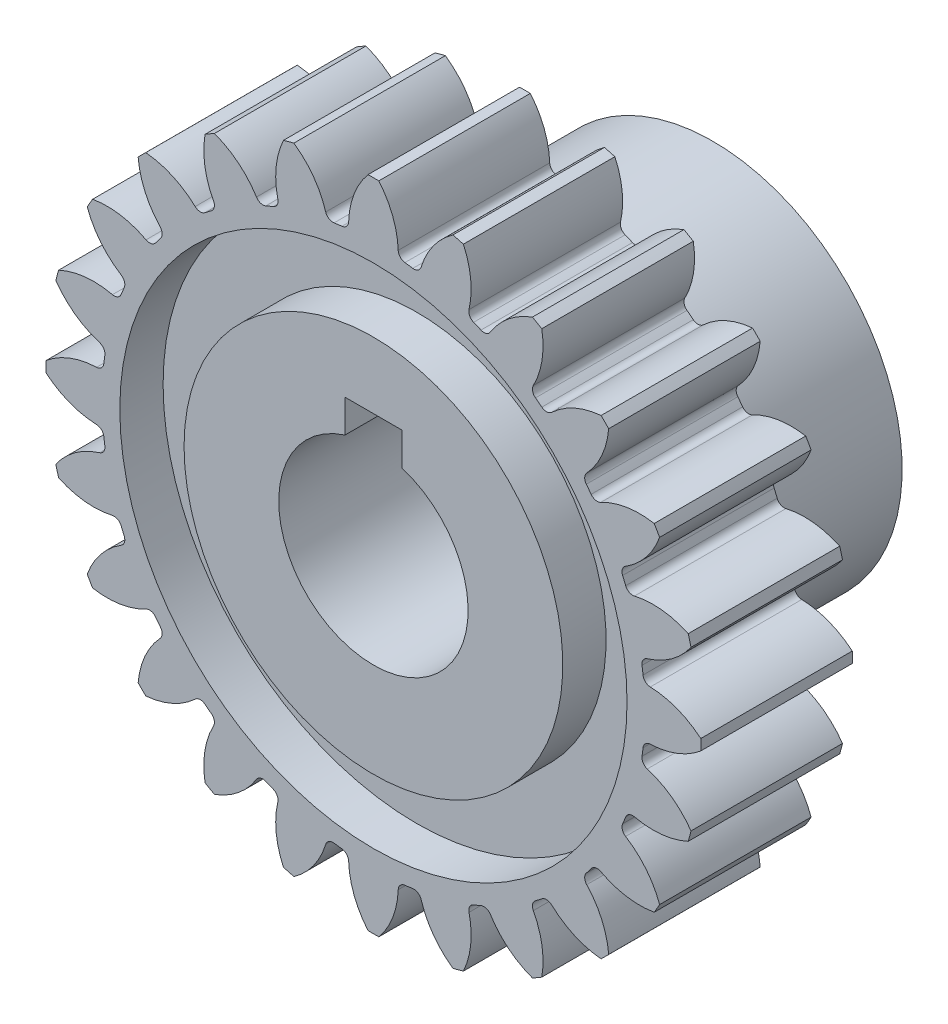
from build123d import *

# Parameters (mm, degrees)
CUT_EXTRUDE1_DEPTH = 25.060921741
CIRPATTERN1_COUNT  = 24
CUT_EXTRUDE2_DEPTH = 25.060921741


with BuildPart() as part:
    # Sketch3 → Revolve1 (revolve)
    with BuildSketch(Plane(origin=(0, 0, 0), x_dir=(0, 0, -1), z_dir=(1, 0, 0)), mode=Mode.PRIVATE) as revolve1_sk:
        Polygon((-7.112, 13.72235), (-0.762, 13.72235), (-0.762, 10.6299), (-2.576285714, 10.6299), (-2.576285714, 7.9375), (7.112, 7.9375), (7.112, 3.175), (-7.112, 3.175), (-7.112, 7.9375), (-5.297714286, 7.9375), (-5.297714286, 10.6299), (-7.112, 10.6299), align=None)
    revolve(revolve1_sk.sketch.rotate(Axis((0, 0, -7.112), (0, 0, 1)), 90), axis=Axis((0, 0, -7.112), (0, 0, 1)))

    # Sketch4 → Cut-Extrude1 (cut, symmetric)
    with BuildSketch(Plane.XY.offset(7.112)):
        with BuildLine():
            ThreePointArc((-0.226165225, 13.7204861), (-0.809623795, 12.730495659), (-1.039023964, 11.604493643))
            ThreePointArc((-1.039023964, 11.604493643), (-1.122909631, 11.400437837), (-1.319504028, 11.300306823))
            ThreePointArc((-1.319504028, 11.300306823), (-1.485007366, 11.279750808), (-1.650191603, 11.256770978))
            ThreePointArc((-1.650191603, 11.256770978), (-1.866003022, 11.302607737), (-1.999843883, 11.477999301))
            ThreePointArc((-1.999843883, 11.477999301), (-2.512858197, 12.506260596), (-3.332664279, 13.311507741))
            ThreePointArc((-3.332664279, 13.311507741), (-1.791126094, 13.604953393), (-0.226165225, 13.7204861))
        make_face()
    cut_extrude1 = extrude(amount=CUT_EXTRUDE1_DEPTH, both=True, mode=Mode.SUBTRACT)

    # CirPattern1: Cut-Extrude1 ×24 about axis
    cirpattern1_axis = Axis((0, 0, 0), (0, 0, 1))
    for i in range(1, CIRPATTERN1_COUNT):
        add(cut_extrude1.rotate(cirpattern1_axis, i * 360 / CIRPATTERN1_COUNT), mode=Mode.SUBTRACT)

    # Sketch5 → Cut-Extrude2 (cut, through all)
    with BuildSketch(Plane(origin=(0, 0, -7.112), x_dir=(-1, 0, 0), z_dir=(0, 0, -1))):
        with BuildLine():
            ThreePointArc((1.190625, 3.785946206), (0, 3.96875), (-1.190625, 3.785946206))
            Line((-1.190625, 3.785946206), (-1.190625, 2.943303775))
            ThreePointArc((-1.190625, 2.943303775), (0, 3.175), (1.190625, 2.943303775))
            Line((1.190625, 2.943303775), (1.190625, 3.785946206))
        make_face()
        with BuildLine():
            Line((-1.190625, 2.943303775), (-1.190625, 3.785946206))
            ThreePointArc((-1.190625, 3.785946206), (-2.347944164, -3.199708544), (3.96875, 0))
            ThreePointArc((3.96875, 0), (3.199708544, 2.347944164), (1.190625, 3.785946206))
            Line((1.190625, 3.785946206), (1.190625, 2.943303775))
            ThreePointArc((1.190625, 2.943303775), (2.632570927, 1.774878957), (3.175, 0))
            ThreePointArc((3.175, 0), (-1.774878957, -2.632570927), (-1.190625, 2.943303775))
        make_face()
        with BuildLine():
            Line((1.190625, 5.159375), (-1.190625, 5.159375))
            Line((-1.190625, 5.159375), (-1.190625, 3.785946206))
            ThreePointArc((-1.190625, 3.785946206), (0, 3.96875), (1.190625, 3.785946206))
            Line((1.190625, 3.785946206), (1.190625, 5.159375))
        make_face()
    extrude(amount=-CUT_EXTRUDE2_DEPTH, mode=Mode.SUBTRACT)


solid = part.part
